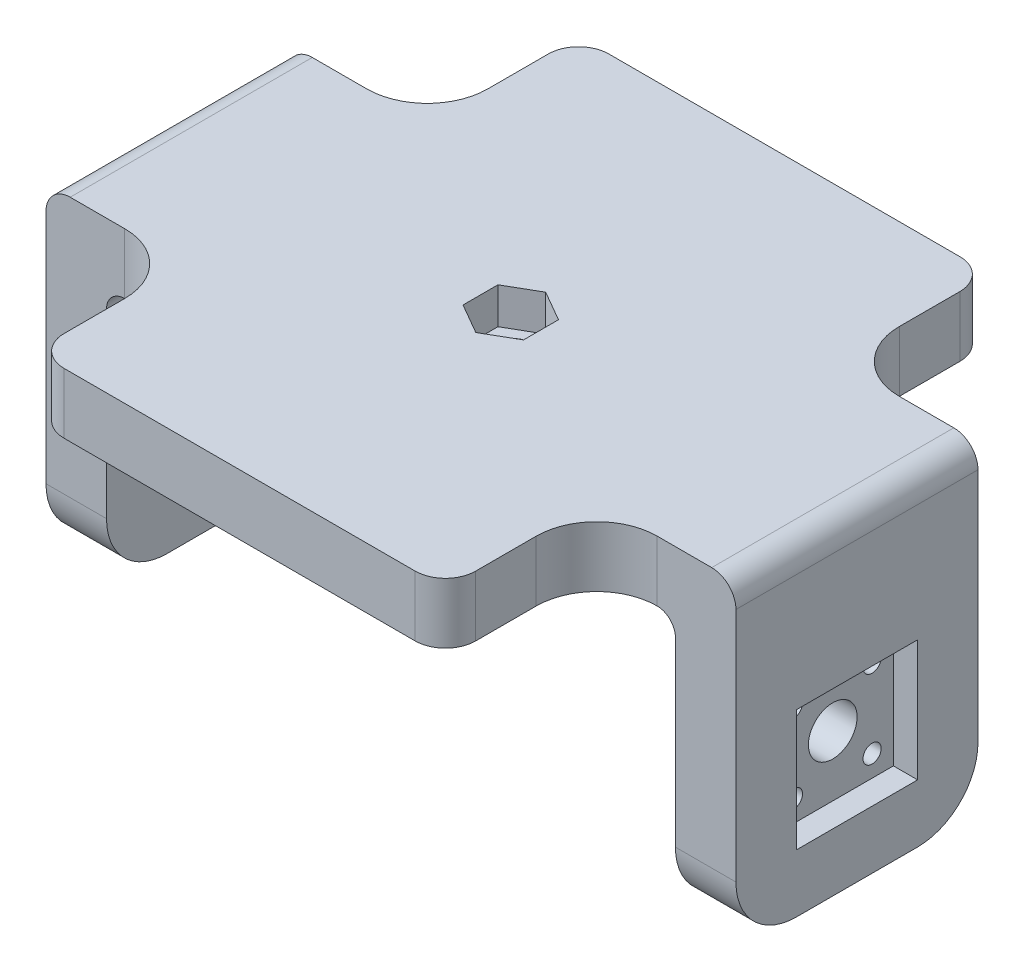
from build123d import *

# Parameters (mm, degrees)
BOSS_EXTRUDE1_DEPTH     = 40
SKETCH2_R               = 12.5
CUT_EXTRUDE1_DEPTH      = 4.4775
FILLET1_R               = 10
CUT_EXTRUDE2_DEPTH      = 131.2
CUT_EXTRUDE2_DEPTH_BACK = 14.2
SKETCH4_R               = 2.5
SKETCH6_W               = 68
SKETCH6_H               = 90
BOSS_EXTRUDE4_DEPTH     = 10
FILLET2_R               = 10
FILLET3_R               = 5
FILLET4_R               = 4
CUT_EXTRUDE3_START      = -2.2025
SKETCH7_R               = 3.9
CUT_EXTRUDE3_DEPTH      = 0.85
SKETCH8_R               = 3.25
CUT_EXTRUDE4_DEPTH      = 10
SKETCH9_R               = 4.025
CUT_EXTRUDE5_DEPTH      = 12
SKETCH10_W              = 20.05
SKETCH10_H              = 20.05
CUT_EXTRUDE6_DEPTH      = 4
CUT_EXTRUDE7_DEPTH      = 6
CUT_EXTRUDE9_DEPTH      = 2.5
CUT_EXTRUDE10_REACH     = 138.104
CUT_EXTRUDE10_START     = -2.5
SKETCH15_R              = 1.5
FILLET5_R               = 3


with BuildPart() as part:
    # Sketch1 → Boss-Extrude1 (new body)
    with BuildSketch(Plane.XY):
        Polygon((10, 0), (10, 43), (104, 43), (104, 0), (114, 0), (114, 53), (0, 53), (0, 0), align=None)
    extrude(amount=-BOSS_EXTRUDE1_DEPTH)

    # Sketch2 → Cut-Extrude1 (cut)
    with BuildSketch(Plane(origin=(10, 0, 0), x_dir=(0, 0, -1), z_dir=(1, 0, 0))):
        with Locations((20, 19.635146369)):
            Circle(SKETCH2_R)
    extrude(amount=-CUT_EXTRUDE1_DEPTH, mode=Mode.SUBTRACT)

    # Fillet1
    fillet1_edges = [part.edges().sort_by_distance(p)[0] for p in [
        (5, 0, 0),
        (109, 0, -40),
        (5, 0, -40),
        (109, 0, 0),
    ]]
    fillet(fillet1_edges, radius=FILLET1_R)

    # Sketch4 → Cut-Extrude2 (cut, two sides: drawn at the far end of the back side and taken through both)
    with BuildSketch(Plane(origin=(7.725, 0, 0), x_dir=(0, 0, -1), z_dir=(1, 0, 0)).offset(-CUT_EXTRUDE2_DEPTH_BACK)):
        with Locations(Location((20, 19.635146369, 0), (0, 0, 180))):
            Circle(SKETCH4_R)
    extrude(amount=CUT_EXTRUDE2_DEPTH + CUT_EXTRUDE2_DEPTH_BACK, mode=Mode.SUBTRACT)

    # Sketch6 → Boss-Extrude4 (add)
    with BuildSketch(Plane(origin=(0, 53, 0), x_dir=(1, 0, 0), z_dir=(0, 1, 0))):
        with Locations((57, 20)):
            Rectangle(SKETCH6_W, SKETCH6_H)
    extrude(amount=-BOSS_EXTRUDE4_DEPTH)

    # Fillet2
    fillet2_edges = [part.edges().sort_by_distance(p)[0] for p in [
        (23, 48, 0),
        (91, 48, 0),
        (91, 48, -40),
        (23, 48, -40),
    ]]
    fillet(fillet2_edges, radius=FILLET2_R)

    # Fillet3
    fillet3_edges = [part.edges().sort_by_distance(p)[0] for p in [
        (23, 48, 25),
        (91, 48, -65),
        (91, 48, 25),
        (23, 48, -65),
    ]]
    fillet(fillet3_edges, radius=FILLET3_R)

    # Fillet4
    fillet4_edges = [part.edges().sort_by_distance(p)[0] for p in [
        (0, 53, -20),
        (114, 53, -20),
    ]]
    fillet(fillet4_edges, radius=FILLET4_R)

    # Sketch7 → Cut-Extrude3 (cut)
    with BuildSketch(Plane(origin=(7.725, 0, 0), x_dir=(0, 0, -1), z_dir=(1, 0, 0)).offset(CUT_EXTRUDE3_START)):
        with Locations((20, 19.635146369)):
            Circle(SKETCH7_R)
    extrude(amount=-CUT_EXTRUDE3_DEPTH, mode=Mode.SUBTRACT)

    # Sketch8 → Cut-Extrude4 (cut)
    with BuildSketch(Plane(origin=(0, 53, 0), x_dir=(1, 0, 0), z_dir=(0, 1, 0))):
        with Locations(Location((57, 20, 0), (0, 0, 270))):
            Circle(SKETCH8_R)
    extrude(amount=-CUT_EXTRUDE4_DEPTH, mode=Mode.SUBTRACT)

    # Sketch9 → Cut-Extrude5 (cut)
    with BuildSketch(Plane(origin=(114, 0, 0), x_dir=(0, 0, -1), z_dir=(1, 0, 0))):
        with Locations(Location((20, 19.635146369, 0), (0, 0, 90))):
            Circle(SKETCH9_R)
    extrude(amount=-CUT_EXTRUDE5_DEPTH, mode=Mode.SUBTRACT)

    # Sketch10 → Cut-Extrude6 (cut)
    with BuildSketch(Plane(origin=(114, 0, 0), x_dir=(0, 0, -1), z_dir=(1, 0, 0))):
        with Locations((20, 19.635146369)):
            Rectangle(SKETCH10_W, SKETCH10_H)
    extrude(amount=-CUT_EXTRUDE6_DEPTH, mode=Mode.SUBTRACT)

    # Sketch14 → Cut-Extrude7 (cut)
    with BuildSketch(Plane(origin=(0, 53, 0), x_dir=(1, 0, 0), z_dir=(0, 1, 0))):
        Polygon((56.872881106, 25.694991584), (61.872881106, 22.808240238), (61.872881106, 17.034737546), (56.872881106, 14.1479862), (51.872881106, 17.034737546), (51.872881106, 22.808240238), align=None)
    extrude(amount=-CUT_EXTRUDE7_DEPTH, mode=Mode.SUBTRACT)

    # Sketch18 → Cut-Extrude9 (cut)
    with BuildSketch(Plane.ZY.offset(-104)):
        Polygon((-15.048857438, 28.91356654), (-11.910134999, 28.91356654), (-10.270487153, 26.081726401), (-11.891583597, 23.249886262), (-15.151000849, 23.249886262), (-16.733963505, 26.081726401), align=None)
        Polygon((-23.266036495, 26.081726401), (-24.951142562, 28.91356654), (-28.089865001, 28.91356654), (-29.729512847, 26.081726401), (-28.108416403, 23.249886262), (-24.848999151, 23.249886262), align=None)
        Polygon((-16.733963505, 13.188566337), (-15.048857438, 10.356726198), (-11.910134999, 10.356726198), (-10.270487153, 13.188566337), (-11.891583597, 16.020406476), (-15.151000849, 16.020406476), align=None)
        Polygon((-24.848999151, 16.020406476), (-23.266036495, 13.188566337), (-24.951142562, 10.356726198), (-28.089865001, 10.356726198), (-29.729512847, 13.188566337), (-28.108416403, 16.020406476), align=None)
    extrude(amount=-CUT_EXTRUDE9_DEPTH, mode=Mode.SUBTRACT)

    # Sketch15 → Cut-Extrude10 (cut, up to next)
    with BuildSketch(Plane.ZY.offset(-104).offset(CUT_EXTRUDE10_START), mode=Mode.PRIVATE) as cut_extrude10_sk1:
        with Locations(Location((-26.5, 26.135146369, 0), (0, 0, 270))):
            Circle(SKETCH15_R)
    cut_extrude10_tool1 = extrude(cut_extrude10_sk1.sketch, amount=-CUT_EXTRUDE10_REACH, mode=Mode.PRIVATE) & part.part
    # Sketch15 → Cut-Extrude10 (cut, up to next)
    with BuildSketch(Plane.ZY.offset(-104).offset(CUT_EXTRUDE10_START), mode=Mode.PRIVATE) as cut_extrude10_sk2:
        with Locations(Location((-13.5, 26.135146369, 0), (0, 0, 270))):
            Circle(SKETCH15_R)
    cut_extrude10_tool2 = extrude(cut_extrude10_sk2.sketch, amount=-CUT_EXTRUDE10_REACH, mode=Mode.PRIVATE) & part.part
    # Sketch15 → Cut-Extrude10 (cut, up to next)
    with BuildSketch(Plane.ZY.offset(-104).offset(CUT_EXTRUDE10_START), mode=Mode.PRIVATE) as cut_extrude10_sk3:
        with Locations(Location((-13.5, 13.135146369, 0), (0, 0, 270))):
            Circle(SKETCH15_R)
    cut_extrude10_tool3 = extrude(cut_extrude10_sk3.sketch, amount=-CUT_EXTRUDE10_REACH, mode=Mode.PRIVATE) & part.part
    # Sketch15 → Cut-Extrude10 (cut, up to next)
    with BuildSketch(Plane.ZY.offset(-104).offset(CUT_EXTRUDE10_START), mode=Mode.PRIVATE) as cut_extrude10_sk4:
        with Locations(Location((-26.5, 13.135146369, 0), (0, 0, 270))):
            Circle(SKETCH15_R)
    cut_extrude10_tool4 = extrude(cut_extrude10_sk4.sketch, amount=-CUT_EXTRUDE10_REACH, mode=Mode.PRIVATE) & part.part
    add(cut_extrude10_tool1.solids().sort_by_distance((106.5, 26.135146, -26.5))[0], mode=Mode.SUBTRACT)
    add(cut_extrude10_tool2.solids().sort_by_distance((106.5, 26.135146, -13.5))[0], mode=Mode.SUBTRACT)
    add(cut_extrude10_tool3.solids().sort_by_distance((106.5, 13.135146, -13.5))[0], mode=Mode.SUBTRACT)
    add(cut_extrude10_tool4.solids().sort_by_distance((106.5, 13.135146, -26.5))[0], mode=Mode.SUBTRACT)

    # Fillet5
    fillet5_edges = [part.edges().sort_by_distance(p)[0] for p in [
        (104, 43, -20),
        (10, 43, -20),
    ]]
    fillet(fillet5_edges, radius=FILLET5_R)


solid = part.part
